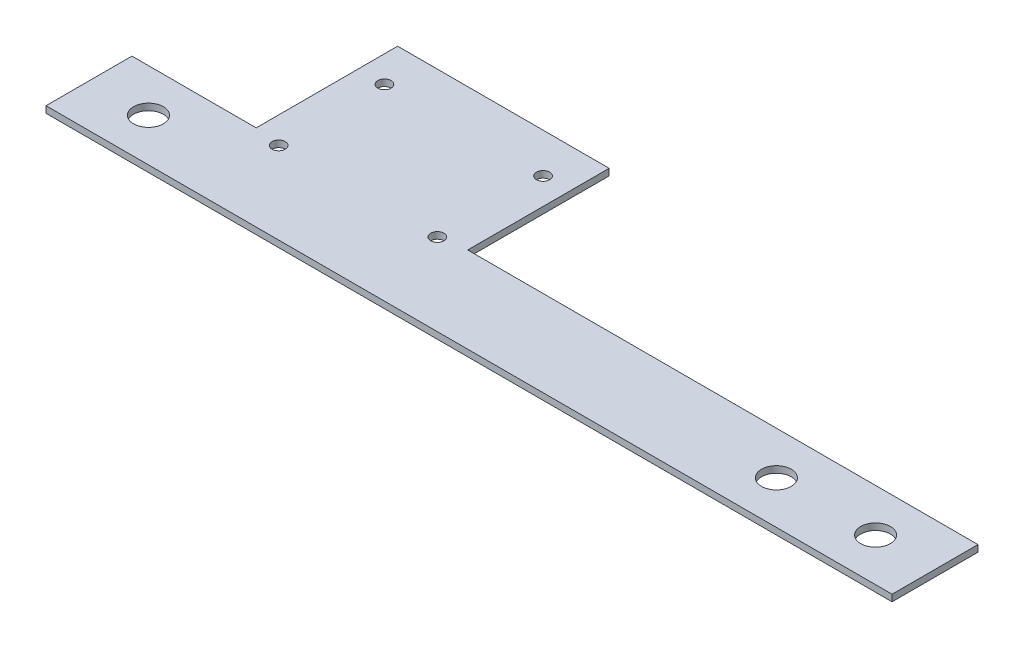
from build123d import *

# Parameters (mm, degrees)
BOSS_EXTRUDE1_DEPTH = 3.175
SKETCH2_R           = 7.14375
SKETCH2_R_2         = 3.175
CUT_EXTRUDE1_DEPTH  = 421.832566498


with BuildPart() as part:
    # Sketch1 → Boss-Extrude1 (new body)
    with BuildSketch(Plane(origin=(0, 0, 0), x_dir=(1, 0, 0), z_dir=(0, 1, 0))):
        Polygon((0, 0), (406.4, 0), (406.4, 41.275), (161.29, 41.275), (161.29, 109.22), (59.69, 109.22), (59.69, 41.275), (0, 41.275), align=None)
    extrude(amount=BOSS_EXTRUDE1_DEPTH)

    # Sketch2 → Cut-Extrude1 (cut, through all)
    with BuildSketch(Plane(origin=(0, 3.175, 0), x_dir=(1, 0, 0), z_dir=(0, 1, 0))):
        with Locations(Location((28.575, 20.6375, 0), (0, 0, 270))):
            Circle(SKETCH2_R)
        with Locations(Location((72.39, 90.17, 0), (0, 0, 270))):
            Circle(SKETCH2_R_2)
        with Locations(Location((330.2, 20.6375, 0), (0, 0, 270))):
            Circle(SKETCH2_R)
        with Locations(Location((377.825, 20.6375, 0), (0, 0, 270))):
            Circle(SKETCH2_R)
        with Locations(Location((72.39, 39.37, 0), (0, 0, 270))):
            Circle(SKETCH2_R_2)
        with Locations(Location((148.59, 39.37, 0), (0, 0, 270))):
            Circle(SKETCH2_R_2)
        with Locations(Location((148.59, 90.17, 0), (0, 0, 270))):
            Circle(SKETCH2_R_2)
    extrude(amount=-CUT_EXTRUDE1_DEPTH, mode=Mode.SUBTRACT)


solid = part.part
